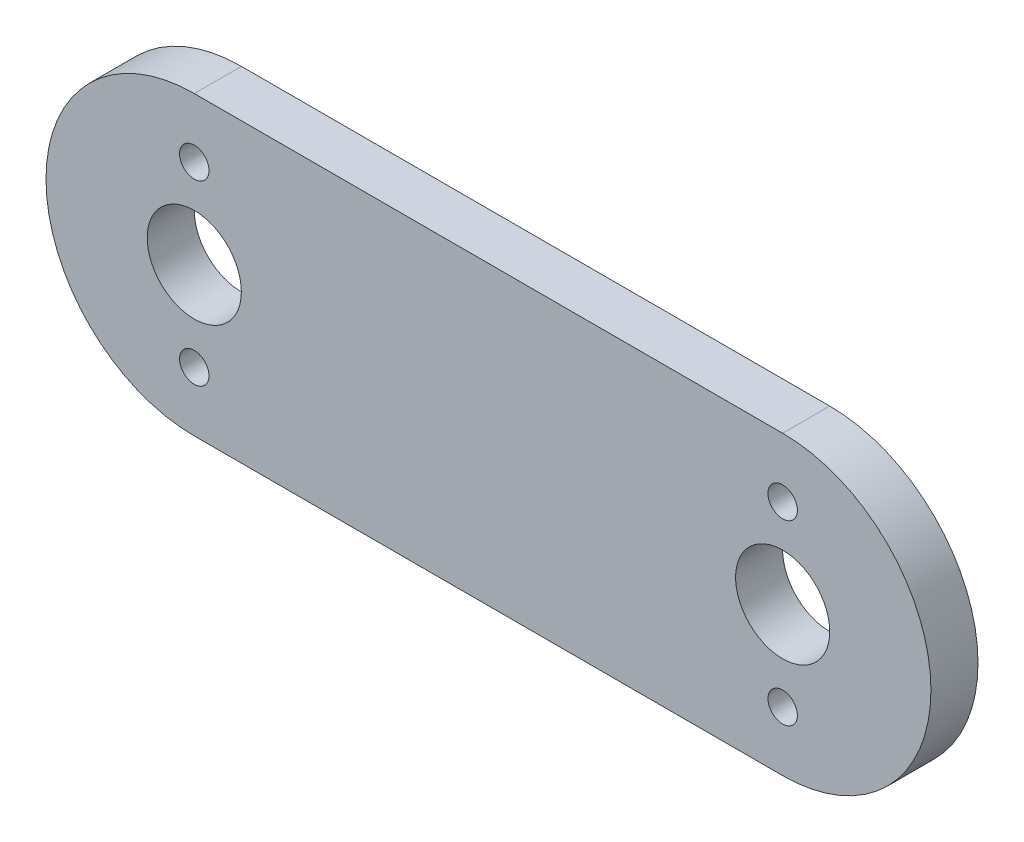
from build123d import *

# Parameters (mm, degrees)
SKETCH1_R           = 4
SKETCH1_R_2         = 1.25
BOSS_EXTRUDE1_DEPTH = 4


with BuildPart() as part:
    # Sketch1 → Boss-Extrude1 (new body)
    with BuildSketch(Plane.XY):
        with BuildLine():
            Line((0, 12.6), (50, 12.6))
            ThreePointArc((50, 12.6), (62.6, 0), (50, -12.6))
            Line((50, -12.6), (0, -12.6))
            ThreePointArc((0, -12.6), (-12.6, 0), (0, 12.6))
        make_face()
        Circle(SKETCH1_R, mode=Mode.SUBTRACT)
        with Locations((50, 0)):
            Circle(SKETCH1_R, mode=Mode.SUBTRACT)
        with Locations((0, 7.55)):
            Circle(SKETCH1_R_2, mode=Mode.SUBTRACT)
        with Locations((0, -7.55)):
            Circle(SKETCH1_R_2, mode=Mode.SUBTRACT)
        with Locations((50, 7.55)):
            Circle(SKETCH1_R_2, mode=Mode.SUBTRACT)
        with Locations((50, -7.55)):
            Circle(SKETCH1_R_2, mode=Mode.SUBTRACT)
    extrude(amount=BOSS_EXTRUDE1_DEPTH)


solid = part.part
